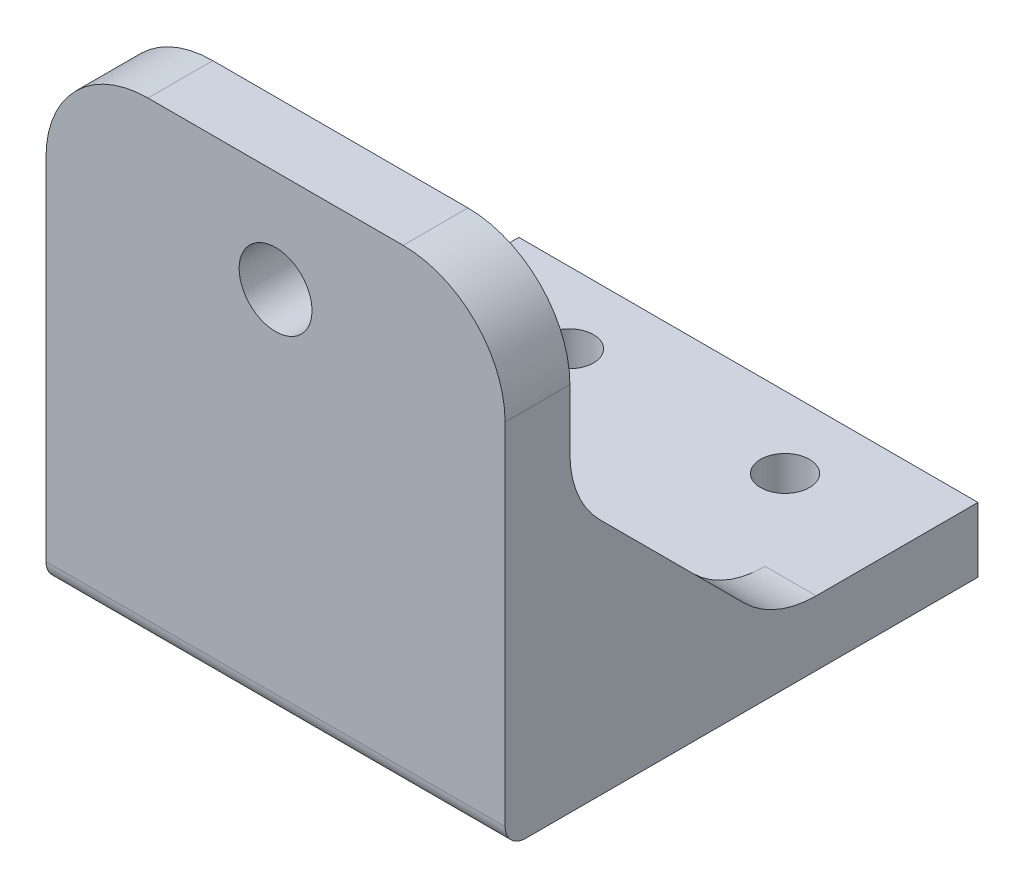
from build123d import *

# Parameters (mm, degrees)
BOSS_EXTRUDE1_DEPTH               = 6.35
M5_CLEARANCE_HOLE1_D              = 5.5
M5_CLEARANCE_HOLE1_CSINK_D        = 5.55
M5_CLEARANCE_HOLE1_CSINK_ANGLE    = 90
SKETCH5_R                         = 12.5
CUT_EXTRUDE1_DEPTH                = 81.949505866
SKETCH12_W                        = 45
SKETCH12_H                        = 46.35
BOSS_EXTRUDE2_DEPTH               = 6.35
F_1_4_CLEARANCE_HOLE1_D           = 7.14248
F_1_4_CLEARANCE_HOLE1_CSINK_D     = 8.41248
F_1_4_CLEARANCE_HOLE1_CSINK_ANGLE = 90
FILLET1_R                         = 10
FILLET2_R                         = 2
SKETCH18_W                        = 106.323058396
SKETCH18_H                        = 71.002809098
CUT_EXTRUDE4_DEPTH                = 60
M4_CLEARANCE_HOLE1_D              = 4.8
BOSS_EXTRUDE3_DEPTH               = 5
FILLET3_R                         = 10
FILLET3_OF_MIRROR1_R              = 10


with BuildPart() as part:
    # Sketch1 → Boss-Extrude1 (new body)
    with BuildSketch(Plane(origin=(0, 0, 0), x_dir=(1, 0, 0), z_dir=(0, 1, 0))):
        with BuildLine():
            Line((-22.5, -77.5), (22.5, -77.5))
            Line((22.5, -77.5), (22.5, 3.34e-07))
            ThreePointArc((22.5, 3.34e-07), (0, 22.5), (-22.5, 3.34e-07))
            Line((-22.5, 3.34e-07), (-22.5, -77.5))
        make_face()
    extrude(amount=BOSS_EXTRUDE1_DEPTH)

    # M5 Clearance Hole1 (through all)
    with Locations(Plane(origin=(0, 6.35, 0), x_dir=(1, 0, 0), z_dir=(0, 1, 0))):
        with Locations((-6.696960066, -16.167891819), (6.696960066, -16.167891819), (6.696960066, 16.167891819), (-6.696960066, 16.167891819)):
            CounterSinkHole(M5_CLEARANCE_HOLE1_D / 2, M5_CLEARANCE_HOLE1_CSINK_D / 2, counter_sink_angle=M5_CLEARANCE_HOLE1_CSINK_ANGLE)

    # Sketch5 → Cut-Extrude1 (cut, through all)
    with BuildSketch(Plane(origin=(0, 6.35, 0), x_dir=(1, 0, 0), z_dir=(0, 1, 0))):
        with Locations(Location((0, 0, 0), (0, 0, 270))):
            Circle(SKETCH5_R)
    extrude(amount=-CUT_EXTRUDE1_DEPTH, mode=Mode.SUBTRACT)

    # Sketch12 → Boss-Extrude2 (add)
    with BuildSketch(Plane.XY.offset(77.5)):
        with Locations((0, 23.175)):
            Rectangle(SKETCH12_W, SKETCH12_H)
    extrude(amount=BOSS_EXTRUDE2_DEPTH)

    # 1/4 Clearance Hole1 (through all)
    with Locations(Plane(origin=(0, 0, 77.5), x_dir=(-1, 0, 0), z_dir=(0, 0, -1))):
        with Locations((0, 36.35)):
            CounterSinkHole(F_1_4_CLEARANCE_HOLE1_D / 2, F_1_4_CLEARANCE_HOLE1_CSINK_D / 2, counter_sink_angle=F_1_4_CLEARANCE_HOLE1_CSINK_ANGLE)

    # Fillet1
    fillet1_edges = [part.edges().sort_by_distance(p)[0] for p in [
        (22.5, 46.35, 80.675),
        (-22.5, 46.35, 80.675),
    ]]
    fillet(fillet1_edges, radius=FILLET1_R)

    # Fillet2
    fillet2_edges = [part.edges().sort_by_distance(p)[0] for p in [
        (0, 6.35, 77.5),
        (0, 0, 83.85),
    ]]
    fillet(fillet2_edges, radius=FILLET2_R)

    # Sketch18 → Cut-Extrude4 (cut)
    with BuildSketch(Plane.XY.offset(-22.5)):
        with Locations((20.664180994, 31.016391908)):
            Rectangle(SKETCH18_W, SKETCH18_H)
    extrude(amount=CUT_EXTRUDE4_DEPTH, mode=Mode.SUBTRACT)

    # M4 Clearance Hole1 (through all)
    with Locations(Plane(origin=(0, 0, 0), x_dir=(-1, 0, 0), z_dir=(0, -1, 0))):
        with Locations((10.58478565, -44.5), (-10.58478565, -44.5)):
            Hole(M4_CLEARANCE_HOLE1_D / 2)

    # Sketch23 → Boss-Extrude3 (add)
    with BuildSketch(Plane.ZY.offset(22.5)):
        Polygon((77.5, 26.35), (57.5, 6.35), (77.5, 6.35), align=None)
    boss_extrude3 = extrude(amount=-BOSS_EXTRUDE3_DEPTH)

    # Fillet3
    fillet3_edges = [part.edges().sort_by_distance(p)[0] for p in [
        (-20, 26.35, 77.5),
        (-20, 6.35, 57.5),
    ]]
    fillet(fillet3_edges, radius=FILLET3_R)

    # Mirror1: Boss-Extrude3 across plane
    add(boss_extrude3.mirror(Plane(origin=(0, 0, 0), x_dir=(0, 0, 1), z_dir=(1, 0, 0))))

    # Fillet3 of Mirror1
    fillet3_of_mirror1_edges = [part.edges().sort_by_distance(p)[0] for p in [
        (20, 26.35, 77.5),
        (20, 6.35, 57.5),
    ]]
    fillet(fillet3_of_mirror1_edges, radius=FILLET3_OF_MIRROR1_R)


solid = part.part
